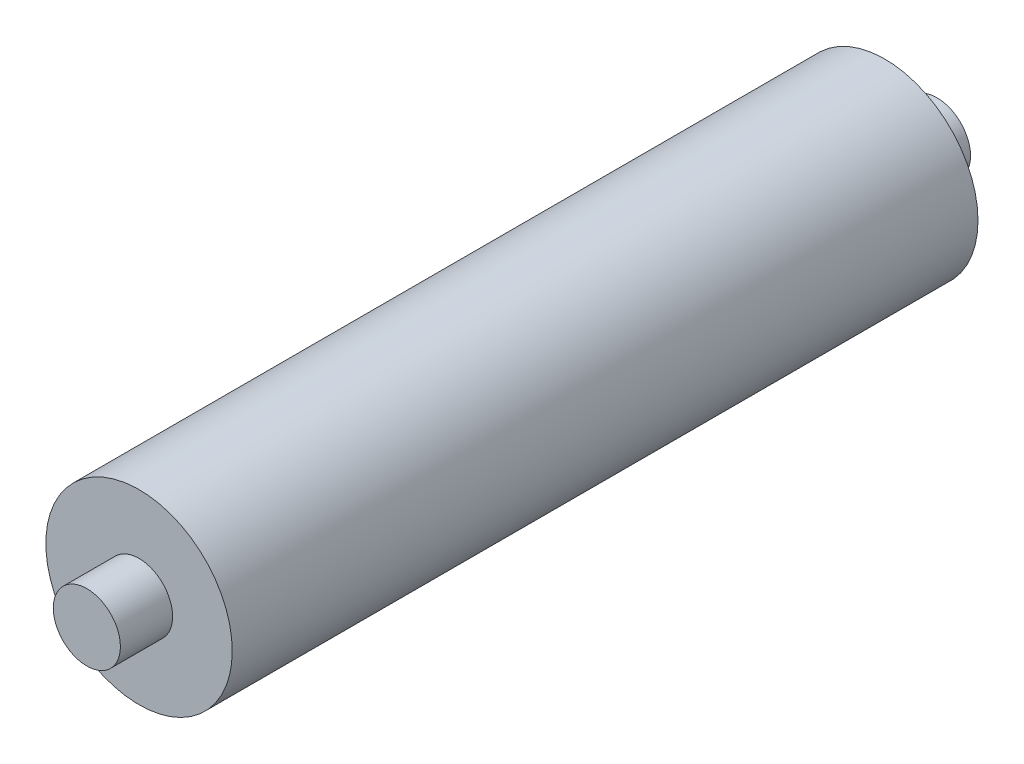
from build123d import *

# Parameters (mm, degrees)
SKETCH2_R           = 4.5
BOSS_EXTRUDE1_DEPTH = 7
SKETCH3_R           = 12.5
BOSS_EXTRUDE2_DEPTH = 50


with BuildPart() as part:
    # Sketch2 → Boss-Extrude1 (new body)
    with BuildSketch(Plane.XY):
        Circle(SKETCH2_R)
    extrude(amount=BOSS_EXTRUDE1_DEPTH)

    # Sketch3 → Boss-Extrude2 (add)
    with BuildSketch(Plane.XY.offset(7)):
        Circle(SKETCH3_R)
    extrude(amount=BOSS_EXTRUDE2_DEPTH)

    # Mirror1: part across plane


with BuildPart() as part_1:
    add(part.part)
    add(part.part.mirror(Plane.XY.offset(57)))


solid = part_1.part
